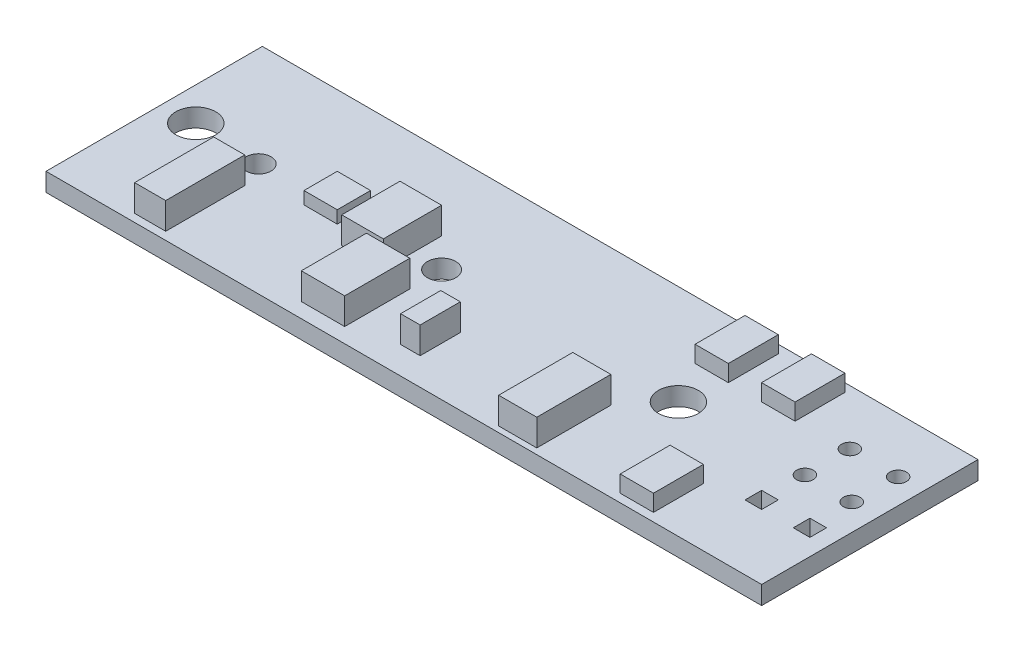
from build123d import *

# Parameters (mm, degrees)
SKETCH1_W           = 43
SKETCH1_H           = 13
SKETCH1_R           = 1.2
SKETCH1_R_2         = 0.5
SKETCH1_W_2         = 1
SKETCH1_H_2         = 1
BOSS_EXTRUDE1_DEPTH = 1.1
SKETCH4_W           = 0.574829242
SKETCH4_H           = 0.46096735
CUT_EXTRUDE3_DEPTH  = 45.935620614
SKETCH2_R           = 0.75
CUT_EXTRUDE1_DEPTH  = 1.1
SKETCH5_R           = 0.85
CUT_EXTRUDE4_DEPTH  = 45.935620614
SKETCH3_W           = 2
SKETCH3_H           = 2
BOSS_EXTRUDE4_DEPTH = 0.75
SKETCH8_W           = 1.866359835
SKETCH8_H           = 4.750734125
SKETCH8_W_2         = 2.60606497
SKETCH8_H_2         = 3.913085661
SKETCH8_W_3         = 1.175159236
SKETCH8_H_3         = 2.413325778
SKETCH8_W_4         = 2.289773106
SKETCH8_H_4         = 4.453019048
SKETCH8_W_5         = 2.5
SKETCH8_H_5         = 3.5
BOSS_EXTRUDE5_DEPTH = 1.6
SKETCH9_W           = 2
SKETCH9_H           = 3
SKETCH9_W_2         = 2.013067154
BOSS_EXTRUDE6_DEPTH = 1
SKETCH11_R          = 1
BOSS_EXTRUDE7_DEPTH = 1.4


with BuildPart() as part:
    # Sketch1 → Boss-Extrude1 (new body)
    with BuildSketch(Plane(origin=(0, 0, 0), x_dir=(1, 0, 0), z_dir=(0, 1, 0))):
        with Locations((21.5, 6.5)):
            Rectangle(SKETCH1_W, SKETCH1_H)
        with Locations(Location((2, 7, 0), (0, 0, 270))):
            Circle(SKETCH1_R, mode=Mode.SUBTRACT)
        with Locations(Location((31, 7, 0), (0, 0, 270))):
            Circle(SKETCH1_R, mode=Mode.SUBTRACT)
        with Locations(Location((38.6, 7, 0), (0, 0, 270))):
            Circle(SKETCH1_R_2, mode=Mode.SUBTRACT)
        with Locations(Location((41.412673615, 7, 0), (0, 0, 270))):
            Circle(SKETCH1_R_2, mode=Mode.SUBTRACT)
        with Locations(Location((38.6, 9.7, 0), (0, 0, 270))):
            Circle(SKETCH1_R_2, mode=Mode.SUBTRACT)
        with Locations(Location((41.5, 9.7, 0), (0, 0, 270))):
            Circle(SKETCH1_R_2, mode=Mode.SUBTRACT)
        with Locations((38.6, 4.4)):
            Rectangle(SKETCH1_W_2, SKETCH1_H_2, mode=Mode.SUBTRACT)
        with Locations((41.5, 4.4)):
            Rectangle(SKETCH1_W_2, SKETCH1_H_2, mode=Mode.SUBTRACT)
    extrude(amount=BOSS_EXTRUDE1_DEPTH)

    # Sketch4 → Cut-Extrude3 (cut, through all)
    with BuildSketch(Plane(origin=(0, 1.1, 0), x_dir=(1, 0, 0), z_dir=(0, 1, 0))):
        with Locations((10.5, 6.769516325)):
            Rectangle(SKETCH4_W, SKETCH4_H)
    extrude(amount=-CUT_EXTRUDE3_DEPTH, mode=Mode.SUBTRACT)

    # Sketch2 → Cut-Extrude1 (cut)
    with BuildSketch(Plane(origin=(0, 1.1, 0), x_dir=(1, 0, 0), z_dir=(0, 1, 0))):
        with Locations(Location((6, 6.769516325, 0), (0, 0, 270))):
            Circle(SKETCH2_R)
    extrude(amount=-CUT_EXTRUDE1_DEPTH, mode=Mode.SUBTRACT)

    # Sketch5 → Cut-Extrude4 (cut, through all)
    with BuildSketch(Plane(origin=(0, 1.1, 0), x_dir=(1, 0, 0), z_dir=(0, 1, 0))):
        with Locations(Location((14, 6.769516325, 0), (0, 0, 270))):
            Circle(SKETCH5_R)
        with Locations(Location((17, 6.769516325, 0), (0, 0, 270))):
            Circle(SKETCH5_R)
    extrude(amount=-CUT_EXTRUDE4_DEPTH, mode=Mode.SUBTRACT)

    # Sketch3 → Boss-Extrude4 (add)
    with BuildSketch(Plane(origin=(0, 1.1, 0), x_dir=(1, 0, 0), z_dir=(0, 1, 0))):
        with Locations((10.5, 7)):
            Rectangle(SKETCH3_W, SKETCH3_H)
    extrude(amount=BOSS_EXTRUDE4_DEPTH)

    # Sketch8 → Boss-Extrude5 (add)
    with BuildSketch(Plane(origin=(0, 1.1, 0), x_dir=(1, 0, 0), z_dir=(0, 1, 0))):
        with Locations((5.784401845, 2.849545168)):
            Rectangle(SKETCH8_W, SKETCH8_H)
        with Locations((15.75, 2.849545168)):
            Rectangle(SKETCH8_W_2, SKETCH8_H_2)
        with Locations((20.25, 2.849545168)):
            Rectangle(SKETCH8_W_3, SKETCH8_H_3)
        with Locations((27.995132783, 2.574921462)):
            Rectangle(SKETCH8_W_4, SKETCH8_H_4)
        with Locations((14, 6.769516325)):
            Rectangle(SKETCH8_W_5, SKETCH8_H_5)
    extrude(amount=BOSS_EXTRUDE5_DEPTH)

    # Sketch9 → Boss-Extrude6 (add)
    with BuildSketch(Plane(origin=(0, 1.1, 0), x_dir=(1, 0, 0), z_dir=(0, 1, 0))):
        with Locations((35, 2)):
            Rectangle(SKETCH9_W, SKETCH9_H)
        with Locations((34.5, 11)):
            Rectangle(SKETCH9_W_2, SKETCH9_H)
        with Locations((30.5, 11)):
            Rectangle(SKETCH9_W, SKETCH9_H)
    extrude(amount=BOSS_EXTRUDE6_DEPTH)

    # Sketch11 → Boss-Extrude7 (add)
    with BuildSketch(Plane(origin=(0, 1.1, 0), x_dir=(1, 0, 0), z_dir=(0, 1, 0))):
        with Locations((14, 6.769516325)):
            Circle(SKETCH11_R)
    extrude(amount=BOSS_EXTRUDE7_DEPTH)


solid = part.part
